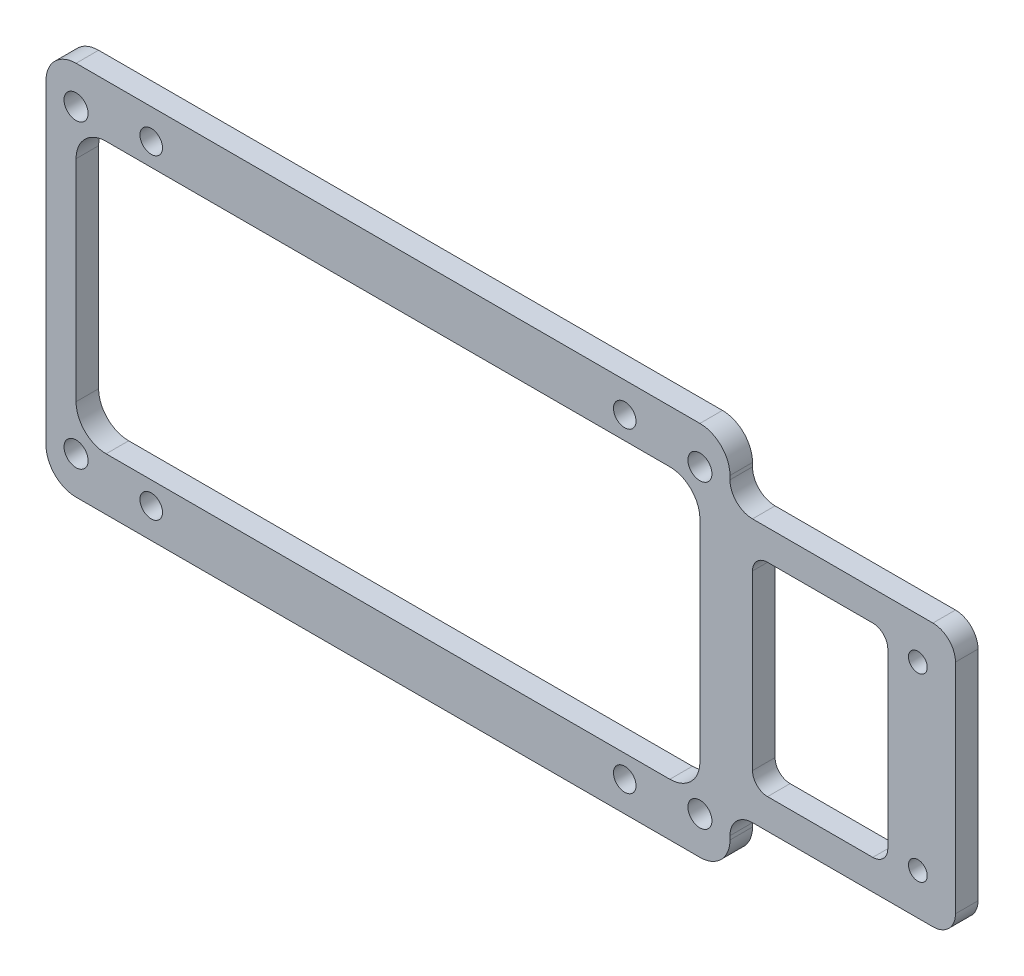
from build123d import *

# Parameters (mm, degrees)
SKETCH_1_W          = 91
SKETCH_1_H          = 50
SKETCH_1_W_2        = 83
SKETCH_1_H_2        = 36
EXTRUDE_1_DEPTH     = 3
SKETCH_2_R          = 1.5
CUT_EXTRUDE_1_DEPTH = 3
SKETCH_3_R          = 1.6
CUT_EXTRUDE_2_DEPTH = 3
FILLET_1_R          = 4
SKETCH_4_W          = 30
SKETCH_4_H          = 35
EXTRUDE_2_DEPTH     = 3
SKETCH_5_R          = 1.25
CUT_EXTRUDE_3_DEPTH = 10
FILLET_2_R          = 3
SKETCH_6_W          = 18
SKETCH_6_H          = 27
CUT_EXTRUDE_4_DEPTH = 10
FILLET_3_R          = 2
SKETCH_7_W          = 38
SKETCH_7_H          = 10
SKETCH_7_R          = 1.6
EXTRUDE_3_DEPTH     = 3
FILLET_4_R          = 2
FILLET_5_R          = 2
SKETCH_8_W          = 42
SKETCH_8_H          = 10
CUT_EXTRUDE_5_DEPTH = 10


with BuildPart() as part:
    # 草图1 → 凸台-拉伸1 (new body)
    with BuildSketch(Plane.XY):
        Rectangle(SKETCH_1_W, SKETCH_1_H)
        Rectangle(SKETCH_1_W_2, SKETCH_1_H_2, mode=Mode.SUBTRACT)
    extrude(amount=EXTRUDE_1_DEPTH)

    # 草图2 → 切除-拉伸1 (cut)
    with BuildSketch(Plane.XY.offset(3)):
        with Locations((31.5, 21)):
            Circle(SKETCH_2_R)
        with Locations((31.5, -21)):
            Circle(SKETCH_2_R)
        with Locations((-31.5, -21)):
            Circle(SKETCH_2_R)
        with Locations((-31.5, 21)):
            Circle(SKETCH_2_R)
    extrude(amount=-CUT_EXTRUDE_1_DEPTH, mode=Mode.SUBTRACT)

    # 草图3 → 切除-拉伸2 (cut)
    with BuildSketch(Plane.XY.offset(3)):
        with Locations((41.5, 20)):
            Circle(SKETCH_3_R)
        with Locations((41.5, -20)):
            Circle(SKETCH_3_R)
        with Locations((-41.5, -20)):
            Circle(SKETCH_3_R)
        with Locations((-41.5, 20)):
            Circle(SKETCH_3_R)
    extrude(amount=-CUT_EXTRUDE_2_DEPTH, mode=Mode.SUBTRACT)

    # 圆角1
    fillet_1_edges = [part.edges().sort_by_distance(p)[0] for p in [
        (41.5, -18, 1.5),
        (41.5, 18, 1.5),
        (-41.5, 18, 1.5),
        (-41.5, -18, 1.5),
        (45.5, -25, 1.5),
        (-45.5, -25, 1.5),
        (-45.5, 25, 1.5),
        (45.5, 25, 1.5),
    ]]
    fillet(fillet_1_edges, radius=FILLET_1_R)

    # 草图4 → 凸台-拉伸2 (add)
    with BuildSketch(Plane(origin=(0, 0, 0), x_dir=(-1, 0, 0), z_dir=(0, 0, -1))):
        with Locations((-60.5, 0)):
            Rectangle(SKETCH_4_W, SKETCH_4_H)
    extrude(amount=-EXTRUDE_2_DEPTH)

    # 草图5 → 切除-拉伸3 (cut)
    with BuildSketch(Plane(origin=(0, 0, 0), x_dir=(-1, 0, 0), z_dir=(0, 0, -1))):
        with Locations((-70.5, -12)):
            Circle(SKETCH_5_R)
        with Locations((-70.5, 12)):
            Circle(SKETCH_5_R)
    extrude(amount=-CUT_EXTRUDE_3_DEPTH, mode=Mode.SUBTRACT)

    # 圆角2
    fillet_2_edges = [part.edges().sort_by_distance(p)[0] for p in [
        (45.5, 17.5, 1.5),
        (45.5, -17.5, 1.5),
        (75.5, -17.5, 1.5),
        (75.5, 17.5, 1.5),
    ]]
    fillet(fillet_2_edges, radius=FILLET_2_R)

    # 草图6 → 切除-拉伸4 (cut)
    with BuildSketch(Plane(origin=(0, 0, 0), x_dir=(-1, 0, 0), z_dir=(0, 0, -1))):
        with Locations((-57.5, 0)):
            Rectangle(SKETCH_6_W, SKETCH_6_H)
    extrude(amount=-CUT_EXTRUDE_4_DEPTH, mode=Mode.SUBTRACT)

    # 圆角3
    fillet_3_edges = [part.edges().sort_by_distance(p)[0] for p in [
        (66.5, -13.5, 1.5),
        (66.5, 13.5, 1.5),
        (48.5, 13.5, 1.5),
        (48.5, -13.5, 1.5),
    ]]
    fillet(fillet_3_edges, radius=FILLET_3_R)

    # 草图7 → 凸台-拉伸3 (add)
    # profile 1 of 2: a face of its own
    with BuildSketch(Plane(origin=(0, 0, 0), x_dir=(-1, 0, 0), z_dir=(0, 0, -1))):
        with Locations((0, 30)):
            Rectangle(SKETCH_7_W, SKETCH_7_H)
        with Locations((-16, 32)):
            Circle(SKETCH_7_R, mode=Mode.SUBTRACT)
        with Locations((16, 32)):
            Circle(SKETCH_7_R, mode=Mode.SUBTRACT)
    # profile 2 of 2: a face of its own
    with BuildSketch(Plane(origin=(0, 0, 0), x_dir=(-1, 0, 0), z_dir=(0, 0, -1))):
        with Locations((0, -30)):
            Rectangle(SKETCH_7_W, SKETCH_7_H)
        with Locations((16, -32)):
            Circle(SKETCH_7_R, mode=Mode.SUBTRACT)
        with Locations((-16, -32)):
            Circle(SKETCH_7_R, mode=Mode.SUBTRACT)
    extrude(amount=-EXTRUDE_3_DEPTH)

    # 圆角4
    fillet_4_edges = [part.edges().sort_by_distance(p)[0] for p in [
        (19, 35, 1.5),
        (-19, 35, 1.5),
        (-19, -35, 1.5),
        (19, -35, 1.5),
    ]]
    fillet(fillet_4_edges, radius=FILLET_4_R)

    # 圆角5
    fillet_5_edges = [part.edges().sort_by_distance(p)[0] for p in [
        (19, 25, 1.5),
        (-19, 25, 1.5),
        (-19, -25, 1.5),
        (19, -25, 1.5),
    ]]
    fillet(fillet_5_edges, radius=FILLET_5_R)

    # 草图8 → 切除-拉伸5 (cut)
    with BuildSketch(Plane.XY.offset(3)):
        with Locations((0, 30)):
            Rectangle(SKETCH_8_W, SKETCH_8_H)
        with Locations((0, -30)):
            Rectangle(SKETCH_8_W, SKETCH_8_H)
    extrude(amount=-CUT_EXTRUDE_5_DEPTH, mode=Mode.SUBTRACT)


solid = part.part
